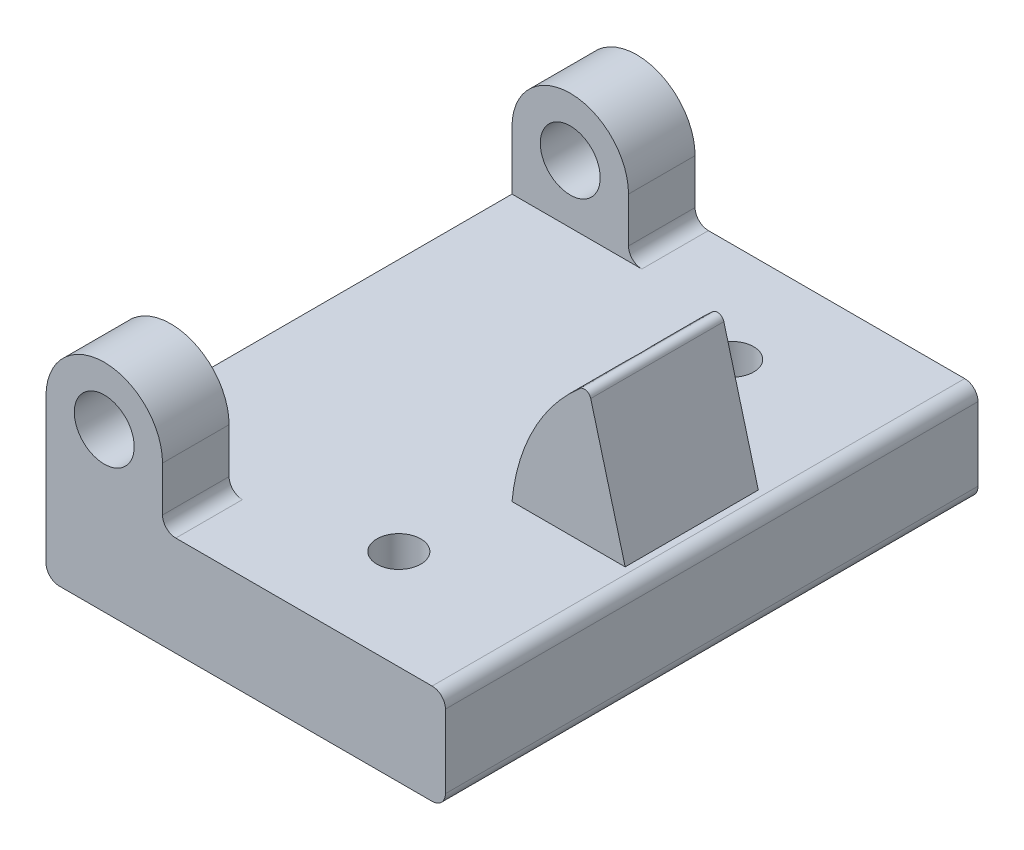
from build123d import *

# Parameters (mm, degrees)
BOSS_EXTRUDE1_DEPTH              = 10
BOSS_EXTRUDE2_DEPTH              = 30
BOSS_EXTRUDE3_DEPTH              = 10
M8_CLEARANCE_HOLE1_D             = 9
TAP_DRILL_FOR_M8X1_25_TAP1_D     = 6.8
TAP_DRILL_FOR_M8X1_25_TAP1_DEPTH = 15
TAP_DRILL_FOR_M8X1_25_TAP1_TIP   = 2.042926105
M6_CLEARANCE_HOLE1_D             = 6.6


with BuildPart() as part:
    # Sketch1 → Boss-Extrude1 (new body)
    with BuildSketch(Plane.XY):
        with BuildLine():
            Line((2, 0), (58, 0))
            ThreePointArc((58, 0), (59.414213562, 0.585786438), (60, 2))
            Line((60, 2), (60, 13))
            ThreePointArc((60, 13), (59.414213562, 14.414213562), (58, 15))
            Line((58, 15), (19.5, 15))
            ThreePointArc((19.5, 15), (18.085786438, 15.585786438), (17.5, 17))
            Line((17.5, 17), (17.5, 23.75))
            ThreePointArc((17.5, 23.75), (8.75, 32.5), (0, 23.75))
            Line((0, 23.75), (0, 2))
            ThreePointArc((0, 2), (0.585786438, 0.585786438), (2, 0))
        make_face()
    boss_extrude1 = extrude(amount=-BOSS_EXTRUDE1_DEPTH)

    # Sketch2 → Boss-Extrude2 (add)
    with BuildSketch(Plane(origin=(0, 0, -10), x_dir=(-1, 0, 0), z_dir=(0, 0, -1))):
        with BuildLine():
            Line((-58, 0), (-2, 0))
            ThreePointArc((-2, 0), (-0.585786438, 0.585786438), (0, 2))
            Line((0, 2), (0, 15))
            Line((0, 15), (-58, 15))
            ThreePointArc((-58, 15), (-59.414213562, 14.414213562), (-60, 13))
            Line((-60, 13), (-60, 2))
            ThreePointArc((-60, 2), (-59.414213562, 0.585786438), (-58, 0))
        make_face()
    boss_extrude2 = extrude(amount=BOSS_EXTRUDE2_DEPTH)

    # Mirror2: Boss-Extrude2 across plane
    add(boss_extrude2.mirror(Plane(origin=(0, 0, -40), x_dir=(1, 0, 0), z_dir=(0, 0, -1))))

    # Mirror3: Boss-Extrude1 across plane
    add(boss_extrude1.mirror(Plane(origin=(0, 0, -40), x_dir=(1, 0, 0), z_dir=(0, 0, -1))))

    # Sketch3 → Boss-Extrude3 (add, symmetric)
    with BuildSketch(Plane(origin=(0, 0, -40), x_dir=(-1, 0, 0), z_dir=(0, 0, -1))):
        with BuildLine():
            Line((-57, 15), (-40, 15))
            ThreePointArc((-40, 15), (-43.192782494, 25.890045982), (-50.202268973, 34.814958355))
            ThreePointArc((-50.202268973, 34.814958355), (-51.150466942, 35.015879251), (-51.823619098, 34.318516526))
            Line((-51.823619098, 34.318516526), (-57, 15))
        make_face()
    extrude(amount=BOSS_EXTRUDE3_DEPTH, both=True)

    # M8 Clearance Hole1 (through all)
    with Locations(Plane.XY):
        with Locations((8.75, 23.75)):
            Hole(M8_CLEARANCE_HOLE1_D / 2)

    # Tap Drill for M8x1.25 Tap1
    with Locations(Plane(origin=(-0.592221329, 33.928337229, 0), x_dir=(0, 0, 1), z_dir=(-0.017452406437290298, 0.9998476951563912, 0))):
        with Locations((-40, 46.802227727)):
            Hole(TAP_DRILL_FOR_M8X1_25_TAP1_D / 2, depth=TAP_DRILL_FOR_M8X1_25_TAP1_DEPTH)
            with Locations((0, 0, -(TAP_DRILL_FOR_M8X1_25_TAP1_DEPTH + TAP_DRILL_FOR_M8X1_25_TAP1_TIP / 2))):  # 118° drill point
                Cone(0, TAP_DRILL_FOR_M8X1_25_TAP1_D / 2, TAP_DRILL_FOR_M8X1_25_TAP1_TIP, mode=Mode.SUBTRACT)

    # M6 Clearance Hole1 (through all)
    with Locations(Plane(origin=(0, 15, 0), x_dir=(1, 0, 0), z_dir=(0, 1, 0))):
        with Locations((38, 15), (38, 65)):
            Hole(M6_CLEARANCE_HOLE1_D / 2)


solid = part.part
